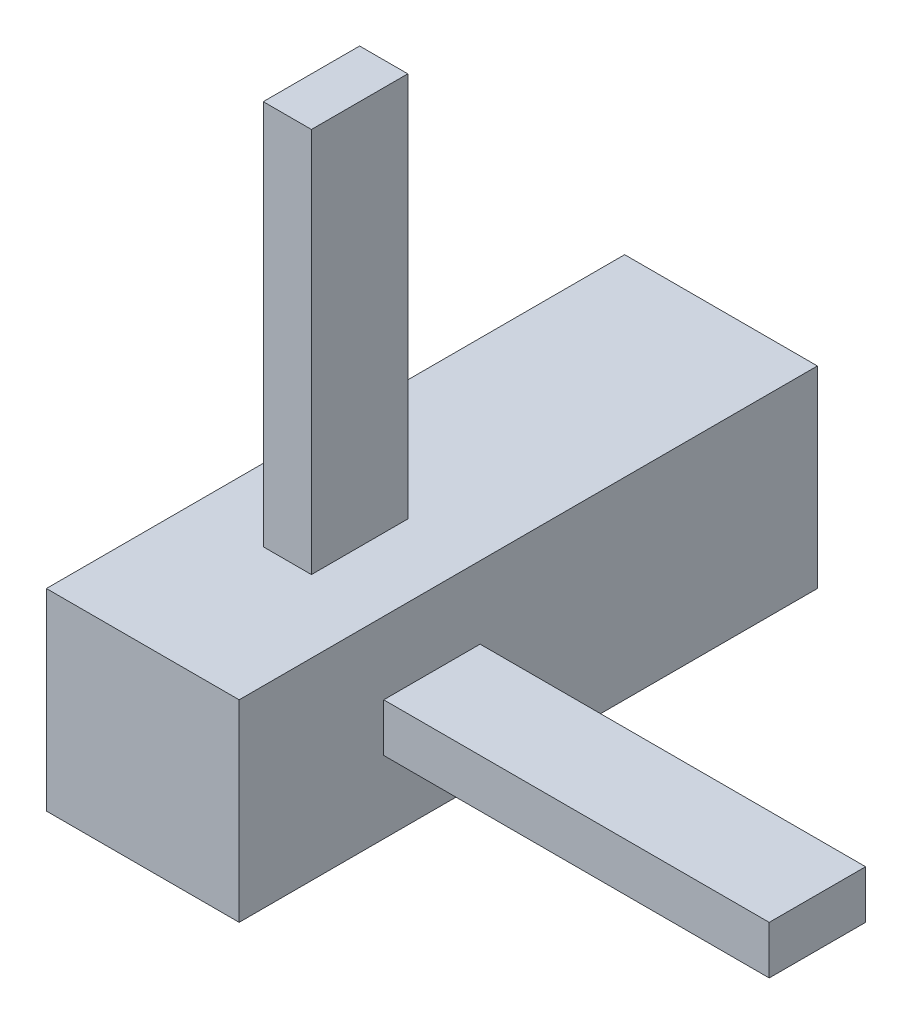
from build123d import *

# Parameters (mm, degrees)
SKETCH2_W           = 0.2
SKETCH2_H           = 0.2
BOSS_EXTRUDE1_DEPTH = 0.6
SKETCH3_W           = 0.1
SKETCH3_H           = 0.05
BOSS_EXTRUDE2_DEPTH = 0.4


with BuildPart() as part:
    # Sketch2 → Boss-Extrude1 (new body)
    with BuildSketch(Plane.XY):
        Rectangle(SKETCH2_W, SKETCH2_H)
    extrude(amount=BOSS_EXTRUDE1_DEPTH)

    # Sketch3 → Boss-Extrude2 (add)
    with BuildSketch(Plane(origin=(0.1, 0, 0), x_dir=(0, 0, -1), z_dir=(1, 0, 0))):
        with Locations((-0.4, 0)):
            Rectangle(SKETCH3_W, SKETCH3_H)
    boss_extrude2 = extrude(amount=BOSS_EXTRUDE2_DEPTH)

    # Mirror1: Boss-Extrude2 across plane
    add(boss_extrude2.mirror(Plane(origin=(0, 0, 0), x_dir=(0, 0, 1), z_dir=(-0.7071067811865477, 0.7071067811865475, 0))))


solid = part.part
